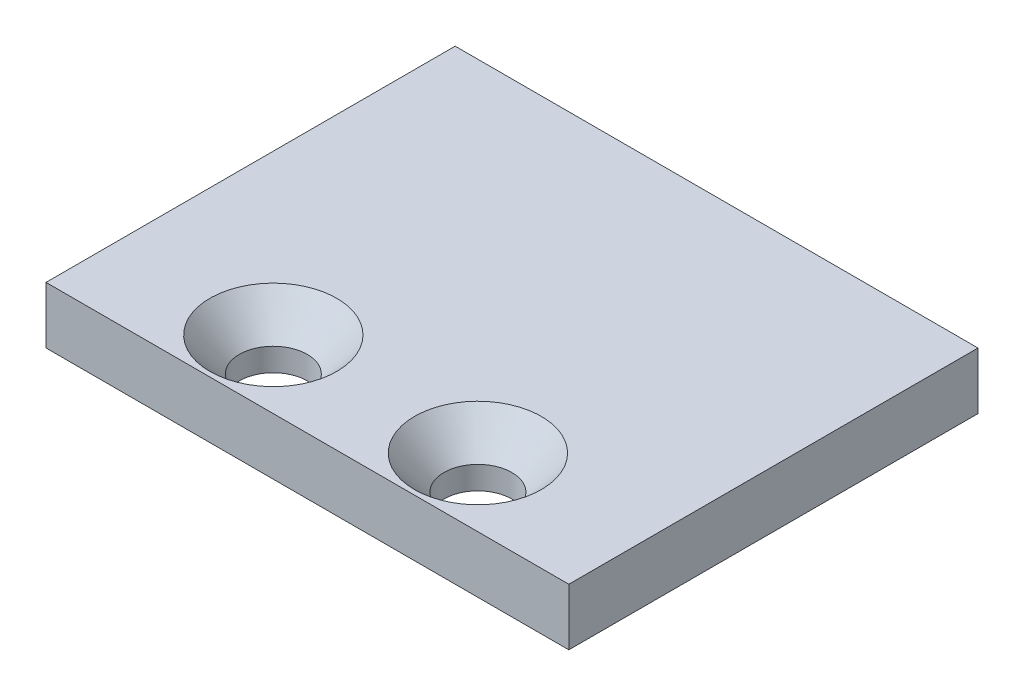
from build123d import *

# Parameters (mm, degrees)
SKETCH1_W                                     = 29.21
SKETCH1_H                                     = 22.86
BOSS_EXTRUDE1_DEPTH                           = 3.175
CSK_FOR_6_FLAT_HEAD_MACHINE_SCREW1_AT_2_COUNT = 2
CSK_FOR_6_FLAT_HEAD_MACHINE_SCREW1_AT_2_PITCH = 11.43


with BuildPart() as part:
    # Sketch1 → Boss-Extrude1 (new body)
    with BuildSketch(Plane(origin=(0, 0, 0), x_dir=(1, 0, 0), z_dir=(0, 1, 0))):
        Rectangle(SKETCH1_W, SKETCH1_H)
    extrude(amount=BOSS_EXTRUDE1_DEPTH)

    # Sketch5 → CSK for #6 Flat Head Machine Screw1 (revolve, cut)
    with BuildSketch(Plane(origin=(-5.715, 3.175, 7.62), x_dir=(0, 0, 1), z_dir=(1, 0, 0))):
        Polygon((0, 0), (0, 3.175), (1.89865, 3.175), (1.89865, 1.891953401), (3.5433, 0), align=None)
    csk_for_6_flat_head_machine_screw1 = revolve(axis=Axis((-5.715, 9.525, 7.62), (0, -1, 0)), mode=Mode.SUBTRACT)

    # CSK for #6 Flat Head Machine Screw1 at 2: CSK for #6 Flat Head Machine Screw1 ×2
    with Locations(*[(i * CSK_FOR_6_FLAT_HEAD_MACHINE_SCREW1_AT_2_PITCH, 0, 0) for i in range(1, CSK_FOR_6_FLAT_HEAD_MACHINE_SCREW1_AT_2_COUNT)]):
        add(csk_for_6_flat_head_machine_screw1, mode=Mode.SUBTRACT)


solid = part.part
